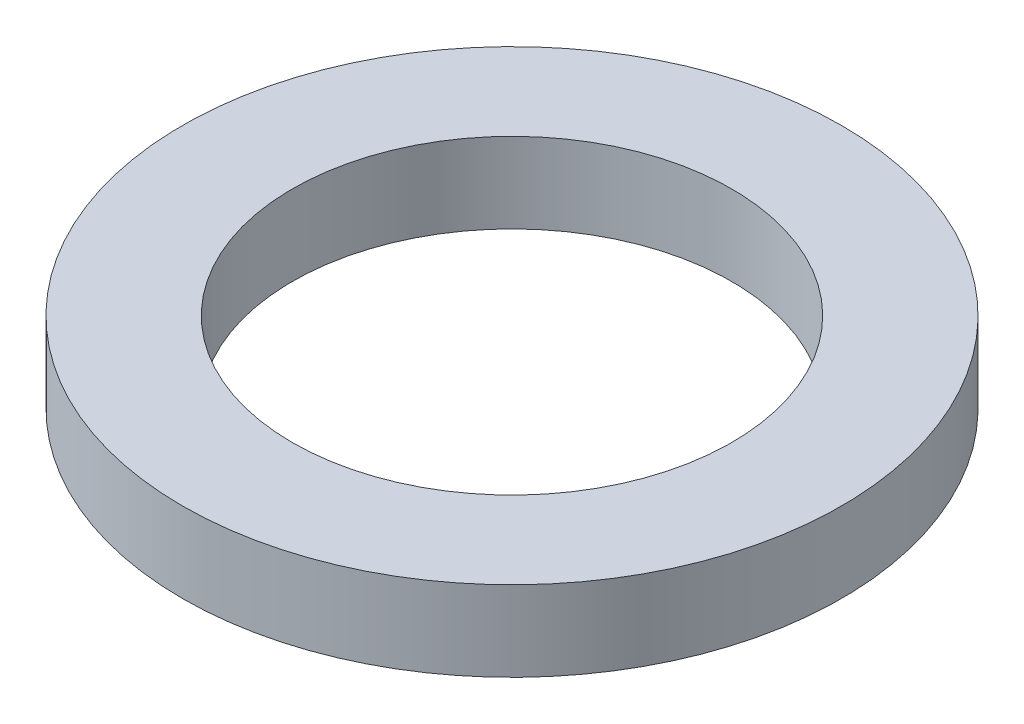
from build123d import *

# Parameters (mm, degrees)
CROQUIS1_R              = 7.5
CROQUIS1_R_2            = 5
SALIENTE_EXTRUIR1_DEPTH = 1.825


with BuildPart() as part:
    # Croquis1 → Saliente-Extruir1 (new body)
    with BuildSketch(Plane(origin=(0, 0, 0), x_dir=(1, 0, 0), z_dir=(0, 1, 0))):
        with Locations(Location((0, 0, 0), (0, 0, 270))):
            Circle(CROQUIS1_R)
        with Locations(Location((0, 0, 0), (0, 0, 270))):
            Circle(CROQUIS1_R_2, mode=Mode.SUBTRACT)
    extrude(amount=SALIENTE_EXTRUIR1_DEPTH)


solid = part.part
